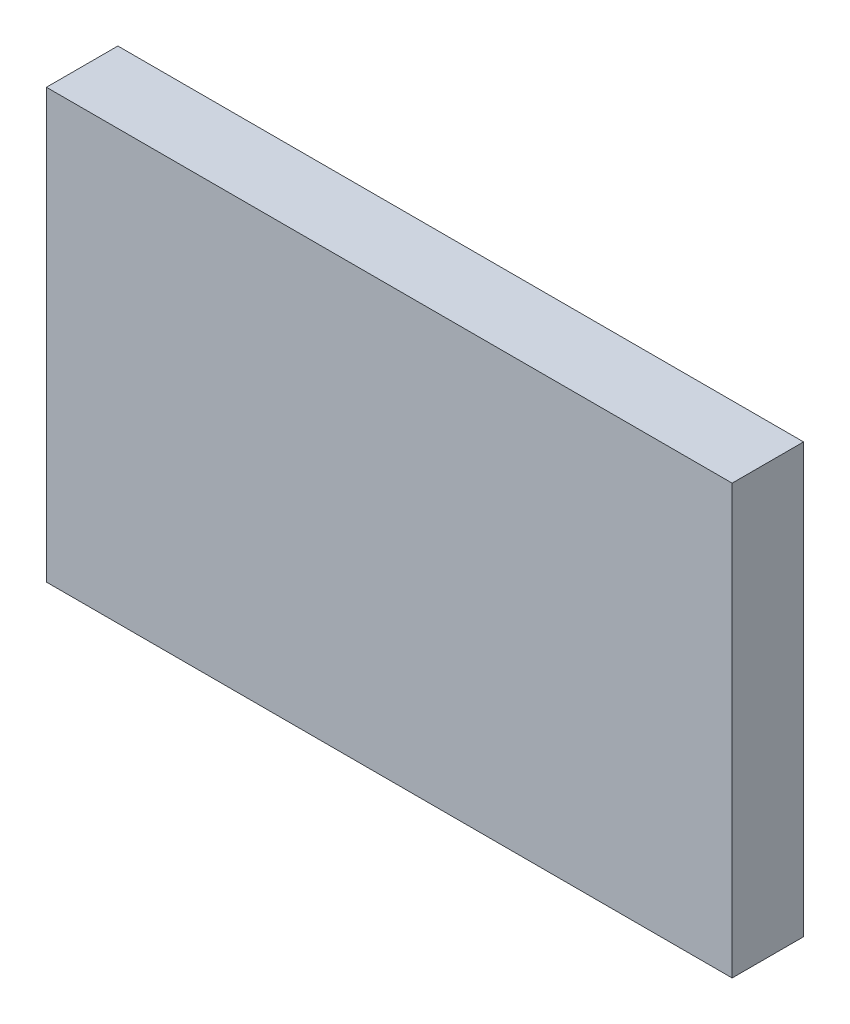
from build123d import *

# Parameters (mm, degrees)
SKETCH1_W           = 48
SKETCH1_H           = 30
BOSS_EXTRUDE1_DEPTH = 5


with BuildPart() as part:
    # Sketch1 → Boss-Extrude1 (new body)
    with BuildSketch(Plane.XY):
        Rectangle(SKETCH1_W, SKETCH1_H)
    extrude(amount=BOSS_EXTRUDE1_DEPTH)


solid = part.part
